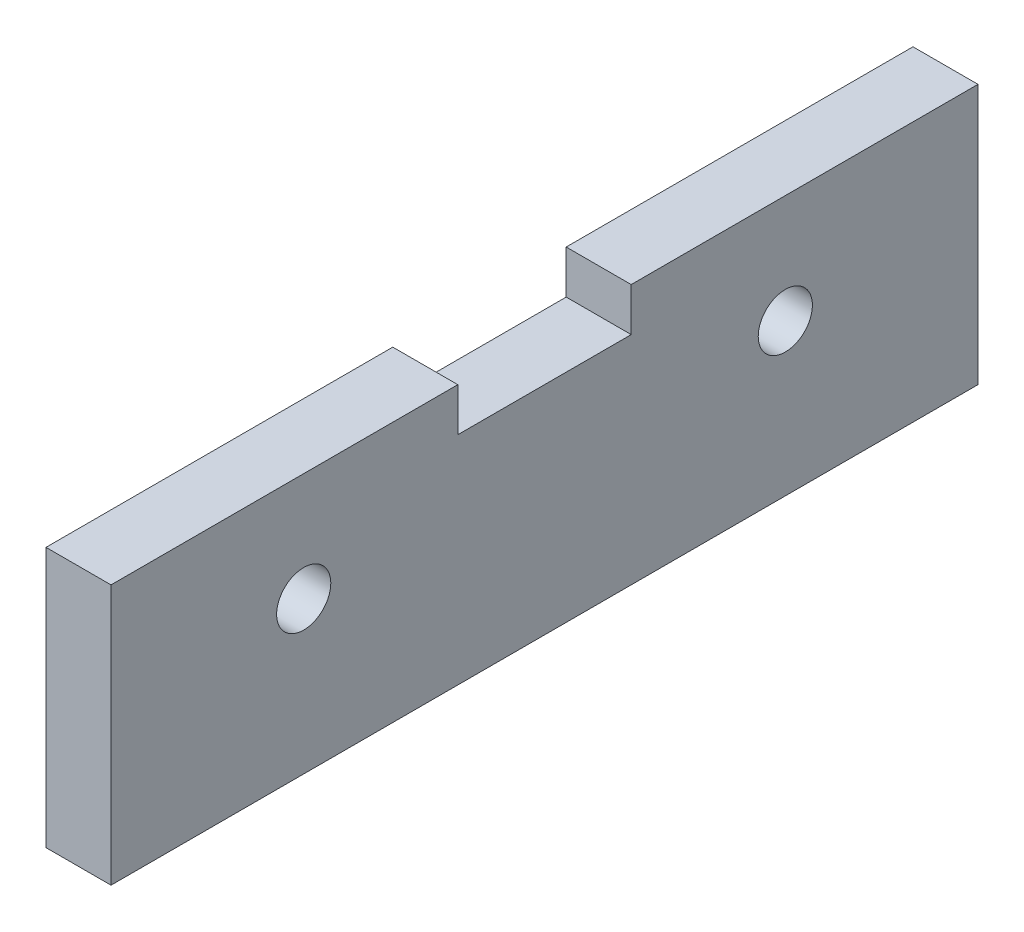
from build123d import *

# Parameters (mm, degrees)
SKETCH1_W           = 40
SKETCH1_H           = 12
BOSS_EXTRUDE1_DEPTH = 3
SKETCH2_R           = 1.25
SKETCH2_W           = 8
SKETCH2_H           = 2
CUT_EXTRUDE1_DEPTH  = 5


with BuildPart() as part:
    # Sketch1 → Boss-Extrude1 (new body)
    with BuildSketch(Plane(origin=(0, 0, 0), x_dir=(0, 0, -1), z_dir=(1, 0, 0))):
        Rectangle(SKETCH1_W, SKETCH1_H)
    extrude(amount=BOSS_EXTRUDE1_DEPTH)

    # Sketch2 → Cut-Extrude1 (cut)
    with BuildSketch(Plane(origin=(3, 0, 0), x_dir=(0, 0, -1), z_dir=(1, 0, 0))):
        with Locations((-11.11, 1)):
            Circle(SKETCH2_R)
        with Locations((0, 5)):
            Rectangle(SKETCH2_W, SKETCH2_H)
    cut_extrude1 = extrude(amount=-CUT_EXTRUDE1_DEPTH, mode=Mode.SUBTRACT)

    # Mirror1: Cut-Extrude1 across plane
    add(cut_extrude1.mirror(Plane.XY), mode=Mode.SUBTRACT)


solid = part.part
